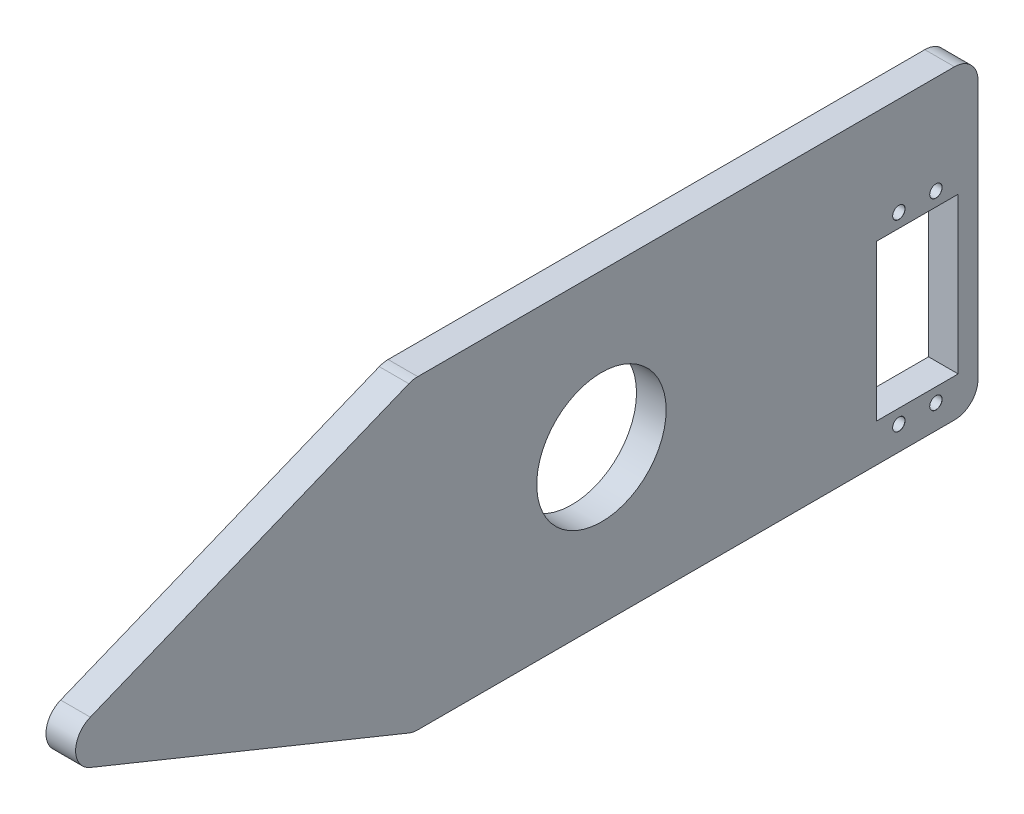
from build123d import *

# Parameters (mm, degrees)
SKETCH1_R                             = 17.4625
BOSS_EXTRUDE2_DEPTH                   = 4.0005
FILLET1_R                             = 6.35
TAP_DRILL_FOR_M4X0_7_TAP1_D           = 3.3
TAP_DRILL_FOR_M4X0_7_TAP1_CSINK_D     = 3.35
TAP_DRILL_FOR_M4X0_7_TAP1_CSINK_ANGLE = 90
SKETCH5_W                             = 42
SKETCH5_H                             = 22
CUT_EXTRUDE1_DEPTH                    = 148.97697313


with BuildPart() as part:
    # Sketch1 → Boss-Extrude2 (new, symmetric)
    with BuildSketch(Plane.YZ):
        Polygon((-41.275, 50.8), (-41.275, -101.6), (41.275, -101.6), (41.275, 50.8), (0, 152.4), align=None)
        with Locations(Location((0, 0, 0), (0, 0, 270))):
            Circle(SKETCH1_R, mode=Mode.SUBTRACT)
    extrude(amount=BOSS_EXTRUDE2_DEPTH, both=True)

    # Fillet1
    fillet1_edges = [part.edges().sort_by_distance(p)[0] for p in [
        (0, 0, 152.4),
        (0, 41.275, 50.8),
        (0, 41.275, -101.6),
        (0, -41.275, -101.6),
        (0, -41.275, 50.8),
    ]]
    fillet(fillet1_edges, radius=FILLET1_R)

    # Tap Drill for M4x0.7 Tap1 (through all)
    with Locations(Plane.YZ.offset(4.0005)):
        with Locations((-34.75, -80.25), (-34.75, -90.25), (14.75, -80.25), (14.75, -90.25)):
            CounterSinkHole(TAP_DRILL_FOR_M4X0_7_TAP1_D / 2, TAP_DRILL_FOR_M4X0_7_TAP1_CSINK_D / 2, counter_sink_angle=TAP_DRILL_FOR_M4X0_7_TAP1_CSINK_ANGLE)

    # Sketch5 → Cut-Extrude1 (cut, through all)
    with BuildSketch(Plane.YZ.offset(4.0005)):
        with Locations((-10, -85.25)):
            Rectangle(SKETCH5_W, SKETCH5_H)
    extrude(amount=-CUT_EXTRUDE1_DEPTH, mode=Mode.SUBTRACT)


solid = part.part
